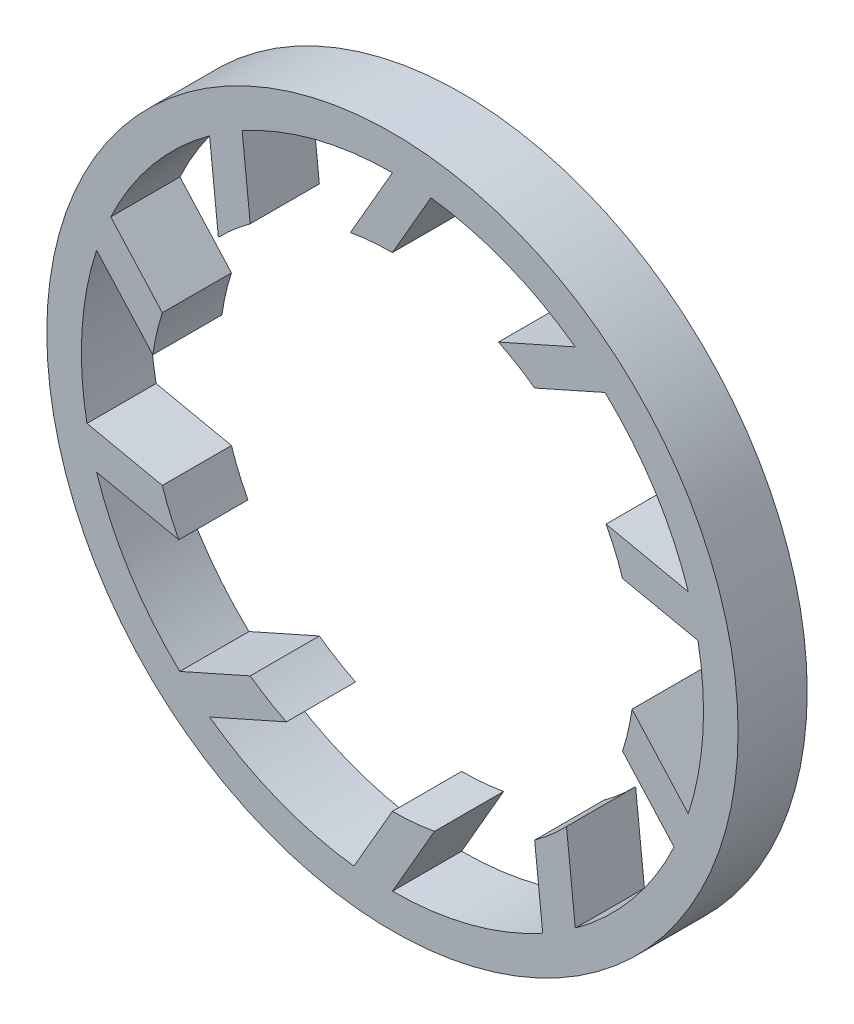
from build123d import *

# Parameters (mm, degrees)
SKETCH1_R           = 25
BOSS_EXTRUDE2_DEPTH = 2.5
SCALE1_SCALE        = 1.5


with BuildPart() as part:
    # Sketch1 → Boss-Extrude2 (new, symmetric)
    with BuildSketch(Plane.XY):
        Circle(SKETCH1_R)
        with BuildLine():
            Line((0, 22.5), (-3.040407483, 17.233859763))
            ThreePointArc((-3.040407483, 17.233859763), (-1.526016734, 17.433337974), (0, 17.5))
            Line((0, 17.5), (2.786730187, 22.32675827))
            ThreePointArc((2.786730187, 22.32675827), (8.267212977, 20.926136519), (13.225168177, 18.202882373))
            Line((13.225168177, 18.202882373), (7.670067285, 15.729592107))
            ThreePointArc((7.670067285, 15.729592107), (9.012485488, 15.000836821), (10.286241915, 14.157797402))
            Line((10.286241915, 14.157797402), (15.377851323, 16.424727964))
            ThreePointArc((15.377851323, 16.424727964), (18.988390227, 12.070254205), (21.398771617, 6.952882373))
            Line((21.398771617, 6.952882373), (15.450837046, 8.217154895))
            ThreePointArc((15.450837046, 8.217154895), (16.108524577, 6.838525862), (16.643489035, 5.407797402))
            Line((16.643489035, 5.407797402), (22.095155927, 4.249009832))
            ThreePointArc((22.095155927, 4.249009832), (22.456647803, -1.396054962), (21.398771617, -6.952882373))
            Line((21.398771617, -6.952882373), (17.329912211, -2.433956196))
            ThreePointArc((17.329912211, -2.433956196), (17.051654786, -3.935869544), (16.643489035, -5.407797402))
            Line((16.643489035, -5.407797402), (20.372861954, -9.549685638))
            ThreePointArc((20.372861954, -9.549685638), (17.347229191, -14.329118584), (13.225168177, -18.202882373))
            Line((13.225168177, -18.202882373), (12.589549933, -12.155378747))
            ThreePointArc((12.589549933, -12.155378747), (11.481632431, -13.206896559), (10.286241915, -14.157797402))
            Line((10.286241915, -14.157797402), (10.868827163, -19.700725776))
            ThreePointArc((10.868827163, -19.700725776), (5.611758639, -21.788945935), (0, -22.5))
            Line((0, -22.5), (3.040407483, -17.233859763))
            ThreePointArc((3.040407483, -17.233859763), (1.526016734, -17.433337974), (0, -17.5))
            Line((0, -17.5), (-2.786730187, -22.32675827))
            ThreePointArc((-2.786730187, -22.32675827), (-8.267212977, -20.926136519), (-13.225168177, -18.202882373))
            Line((-13.225168177, -18.202882373), (-7.670067285, -15.729592107))
            ThreePointArc((-7.670067285, -15.729592107), (-9.012485488, -15.000836821), (-10.286241915, -14.157797402))
            Line((-10.286241915, -14.157797402), (-15.377851323, -16.424727964))
            ThreePointArc((-15.377851323, -16.424727964), (-18.988390227, -12.070254205), (-21.398771617, -6.952882373))
            Line((-21.398771617, -6.952882373), (-15.450837046, -8.217154895))
            ThreePointArc((-15.450837046, -8.217154895), (-16.108524577, -6.838525862), (-16.643489035, -5.407797402))
            Line((-16.643489035, -5.407797402), (-22.095155927, -4.249009832))
            ThreePointArc((-22.095155927, -4.249009832), (-22.456647803, 1.396054962), (-21.398771617, 6.952882373))
            Line((-21.398771617, 6.952882373), (-17.329912211, 2.433956196))
            ThreePointArc((-17.329912211, 2.433956196), (-17.051654786, 3.935869544), (-16.643489035, 5.407797402))
            Line((-16.643489035, 5.407797402), (-20.372861954, 9.549685638))
            ThreePointArc((-20.372861954, 9.549685638), (-17.347229191, 14.329118584), (-13.225168177, 18.202882373))
            Line((-13.225168177, 18.202882373), (-12.589549933, 12.155378747))
            ThreePointArc((-12.589549933, 12.155378747), (-11.481632431, 13.206896559), (-10.286241915, 14.157797402))
            Line((-10.286241915, 14.157797402), (-10.868827163, 19.700725776))
            ThreePointArc((-10.868827163, 19.700725776), (-5.611758639, 21.788945935), (0, 22.5))
        make_face(mode=Mode.SUBTRACT)
    extrude(amount=BOSS_EXTRUDE2_DEPTH, both=True)


with BuildPart() as part_1:
    # Scale1: scaled about (0, 0, 0)
    add(part.part.scale(SCALE1_SCALE))


solid = part_1.part
